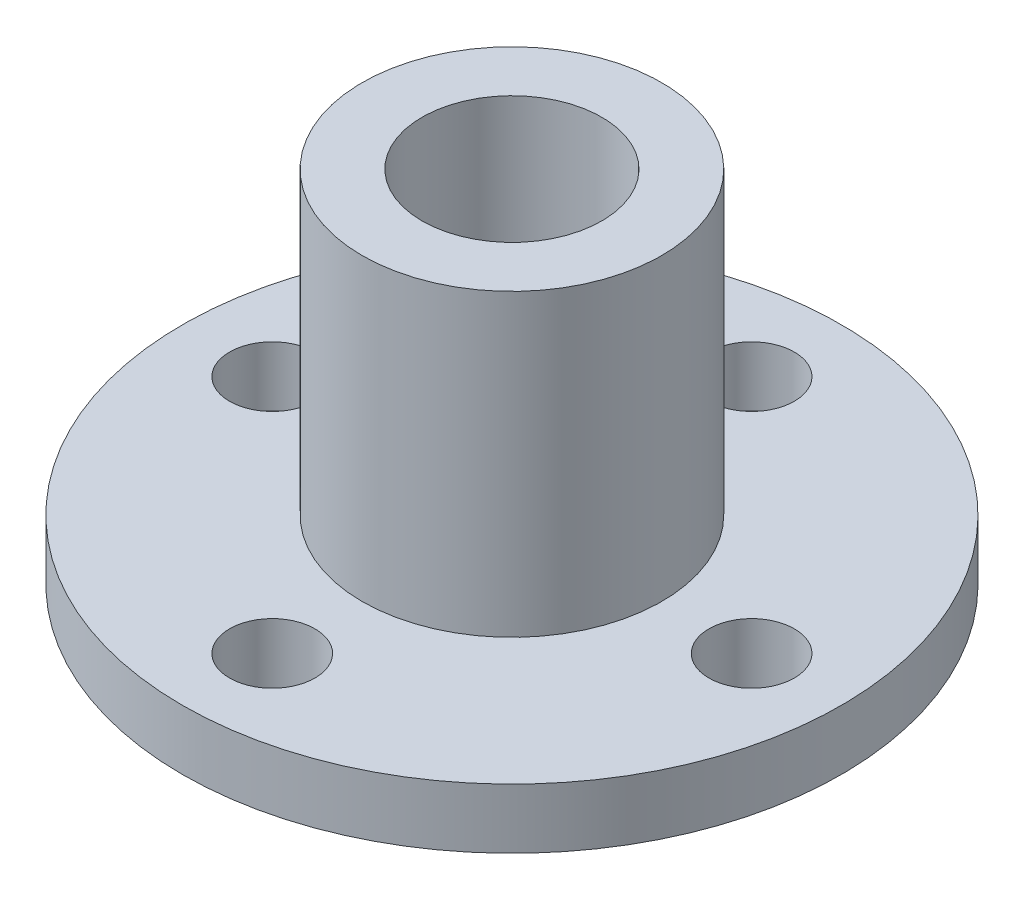
from build123d import *

# Parameters (mm, degrees)
SKETCH1_R           = 11
BOSS_EXTRUDE1_DEPTH = 2
SKETCH2_R           = 5
BOSS_EXTRUDE2_DEPTH = 10
SKETCH3_R           = 3
CUT_EXTRUDE1_DEPTH  = 20.646882704
SKETCH4_R           = 1.425
CUT_EXTRUDE2_DEPTH  = 19.493242009


with BuildPart() as part:
    # Sketch1 → Boss-Extrude1 (new body)
    with BuildSketch(Plane(origin=(0, 0, 0), x_dir=(1, 0, 0), z_dir=(0, 1, 0))):
        with Locations(Location((0, 0, 0), (0, 0, 270))):
            Circle(SKETCH1_R)
    extrude(amount=BOSS_EXTRUDE1_DEPTH)

    # Sketch2 → Boss-Extrude2 (add)
    with BuildSketch(Plane(origin=(0, 2, 0), x_dir=(1, 0, 0), z_dir=(0, 1, 0))):
        with Locations(Location((0, 0, 0), (0, 0, 270))):
            Circle(SKETCH2_R)
    extrude(amount=BOSS_EXTRUDE2_DEPTH)

    # Sketch3 → Cut-Extrude1 (cut, through all)
    with BuildSketch(Plane(origin=(0, 12, 0), x_dir=(1, 0, 0), z_dir=(0, 1, 0))):
        with Locations(Location((0, 0, 0), (0, 0, 270))):
            Circle(SKETCH3_R)
    extrude(amount=-CUT_EXTRUDE1_DEPTH, mode=Mode.SUBTRACT)

    # Sketch4 → Cut-Extrude2 (cut, through all)
    with BuildSketch(Plane(origin=(0, 2, 0), x_dir=(1, 0, 0), z_dir=(0, 1, 0))):
        with Locations(Location((0, 8, 0), (0, 0, 270))):
            Circle(SKETCH4_R)
        with Locations(Location((8, 0, 0), (0, 0, 270))):
            Circle(SKETCH4_R)
        with Locations(Location((0, -8, 0), (0, 0, 270))):
            Circle(SKETCH4_R)
        with Locations(Location((-8, 0, 0), (0, 0, 270))):
            Circle(SKETCH4_R)
    extrude(amount=-CUT_EXTRUDE2_DEPTH, mode=Mode.SUBTRACT)


solid = part.part
